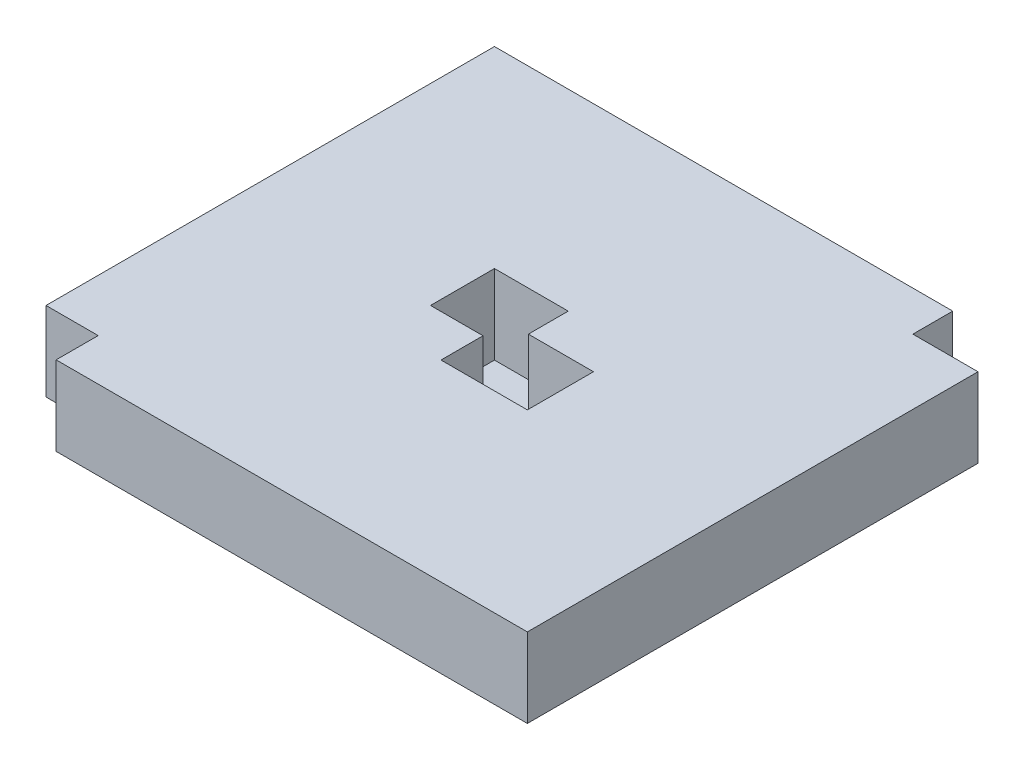
from build123d import *

# Parameters (mm, degrees)
SKIZZE1_R                       = 49.571868138
AUFSATZ_LINEAR_AUSTRAGEN6_DEPTH = 33
LINEAR_AUSTRAGEN_D_NN9_DEPTH    = 33


with BuildPart() as part:
    # Skizze1 → Aufsatz-Linear austragen6 (new body)
    with BuildSketch(Plane(origin=(0, 0, 0), x_dir=(1, 0, 0), z_dir=(0, 1, 0))):
        with Locations(Location((0, 0, 0), (0, 0, 270))):
            Circle(SKIZZE1_R)
    extrude(amount=AUFSATZ_LINEAR_AUSTRAGEN6_DEPTH)

    # Skizze2 → Linear-Austragen-Dünn9 (add)
    with BuildSketch(Plane(origin=(0, 33, 0), x_dir=(1, 0, 0), z_dir=(0, 1, 0))):
        Polygon((-8.848811268, 0), (-30.694314085, 0), (-30.694314085, 26.615565141), (0, 26.615565141), (0, 10.300569366), (80, 10.300569366), (80, 106.615565141), (-110.694314085, 106.615565141), (-110.694314085, -80), (-8.848811268, -80), align=None)
        Polygon((0, 10.024044014), (27.099484508, 10.024044014), (27.099484508, -17.490228521), (-8.987073944, -17.490228521), (-8.987073944, 0), (-88.987073944, 0), (-88.987073944, -97.490228521), (107.099484508, -97.490228521), (107.099484508, 90.024044014), (0, 90.024044014), align=None)
    extrude(amount=LINEAR_AUSTRAGEN_D_NN9_DEPTH)


solid = part.part
